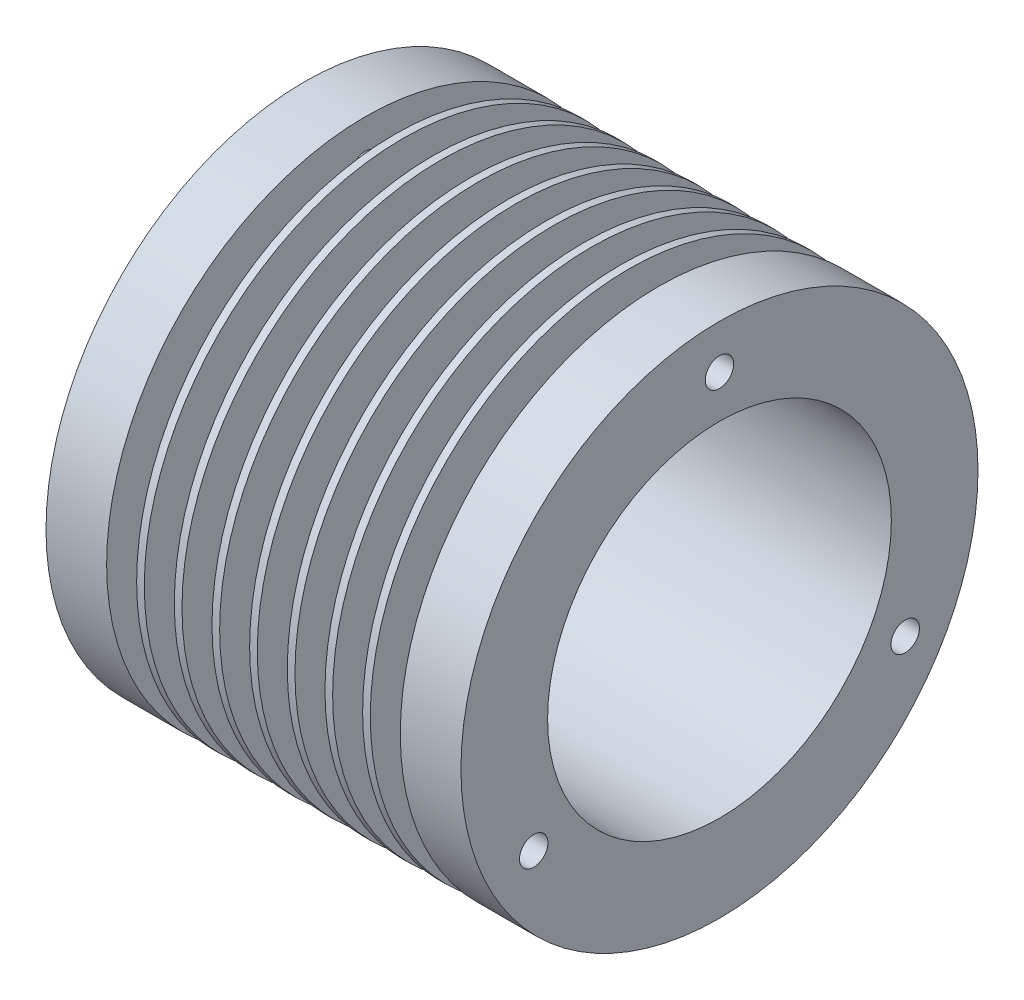
from build123d import *

# Parameters (mm, degrees)
SKETCH2_R                  = 13.6779
CUT_EXTRUDE1_DEPTH         = 45.010218722
F_4_40_TAPPED_HOLE2_REACH  = 46.01
F_4_40_TAPPED_HOLE2_BORE_R = 1.1303
CIRPATTERN1_COUNT          = 3
F_4_40_TAPPED_HOLE3_REACH  = 46.01
F_4_40_TAPPED_HOLE3_BORE_R = 1.1303
CIRPATTERN2_COUNT          = 3


with BuildPart() as part:
    # Sketch1 → Revolve1 (revolve)
    with BuildSketch(Plane.XY, mode=Mode.PRIVATE) as revolve1_sk:
        Polygon((4.826, 20.574), (4.826, 14.605), (7.2136, 14.605), (7.2136, 20.574), (7.8232, 20.574), (7.8232, 14.605), (10.2108, 14.605), (10.2108, 20.574), (10.8204, 20.574), (10.8204, 14.605), (13.208, 14.605), (13.208, 20.574), (13.8176, 20.574), (13.8176, 14.605), (16.2052, 14.605), (16.2052, 20.574), (16.8148, 20.574), (16.8148, 14.605), (19.2024, 14.605), (19.2024, 20.574), (19.812, 20.574), (19.812, 14.605), (22.1996, 14.605), (22.1996, 20.574), (22.8092, 20.574), (22.8092, 14.605), (25.1968, 14.605), (25.1968, 20.574), (25.8064, 20.574), (25.8064, 14.605), (28.194, 14.605), (28.194, 20.574), (33.02, 20.574), (33.02, 0), (0, 0), (0, 20.574), align=None)
    revolve(revolve1_sk.sketch.rotate(Axis((0, 0, 0), (1, 0, 0)), 90), axis=Axis((0, 0, 0), (1, 0, 0)))

    # Sketch2 → Cut-Extrude1 (cut, through all)
    with BuildSketch(Plane.ZY):
        Circle(SKETCH2_R)
    extrude(amount=-CUT_EXTRUDE1_DEPTH, mode=Mode.SUBTRACT)

    # #4-40 Tapped Hole2 bore → #4-40 Tapped Hole2 (cut, up to next)
    with BuildSketch(Plane.ZY, mode=Mode.PRIVATE) as f_4_40_tapped_hole2_sk1:
        with Locations((0, 17.0688)):
            Circle(F_4_40_TAPPED_HOLE2_BORE_R)
    f_4_40_tapped_hole2_tool1 = extrude(f_4_40_tapped_hole2_sk1.sketch, amount=-F_4_40_TAPPED_HOLE2_REACH, mode=Mode.PRIVATE) & part.part
    f_4_40_tapped_hole2 = f_4_40_tapped_hole2_tool1.solids().sort_by_distance((0, 17.0688, 0))[0]
    add(f_4_40_tapped_hole2, mode=Mode.SUBTRACT)

    # CirPattern1: #4-40 Tapped Hole2 ×3 about axis
    cirpattern1_axis = Axis((0, 0, 0), (1, 0, 0))
    for i in range(1, CIRPATTERN1_COUNT):
        add(f_4_40_tapped_hole2.rotate(cirpattern1_axis, i * 360 / CIRPATTERN1_COUNT), mode=Mode.SUBTRACT)

    # #4-40 Tapped Hole3 bore → #4-40 Tapped Hole3 (cut, up to next)
    with BuildSketch(Plane(origin=(33.02, 0, 0), x_dir=(0, 0, -1), z_dir=(1, 0, 0)), mode=Mode.PRIVATE) as f_4_40_tapped_hole3_sk1:
        with Locations((0, 17.0688)):
            Circle(F_4_40_TAPPED_HOLE3_BORE_R)
    f_4_40_tapped_hole3_tool1 = extrude(f_4_40_tapped_hole3_sk1.sketch, amount=-F_4_40_TAPPED_HOLE3_REACH, mode=Mode.PRIVATE) & part.part
    f_4_40_tapped_hole3 = f_4_40_tapped_hole3_tool1.solids().sort_by_distance((33.02, 17.0688, 0))[0]
    add(f_4_40_tapped_hole3, mode=Mode.SUBTRACT)

    # CirPattern2: #4-40 Tapped Hole3 ×3 about axis
    cirpattern2_axis = Axis((0, 0, 0), (1, 0, 0))
    for i in range(1, CIRPATTERN2_COUNT):
        add(f_4_40_tapped_hole3.rotate(cirpattern2_axis, i * 360 / CIRPATTERN2_COUNT), mode=Mode.SUBTRACT)


solid = part.part
